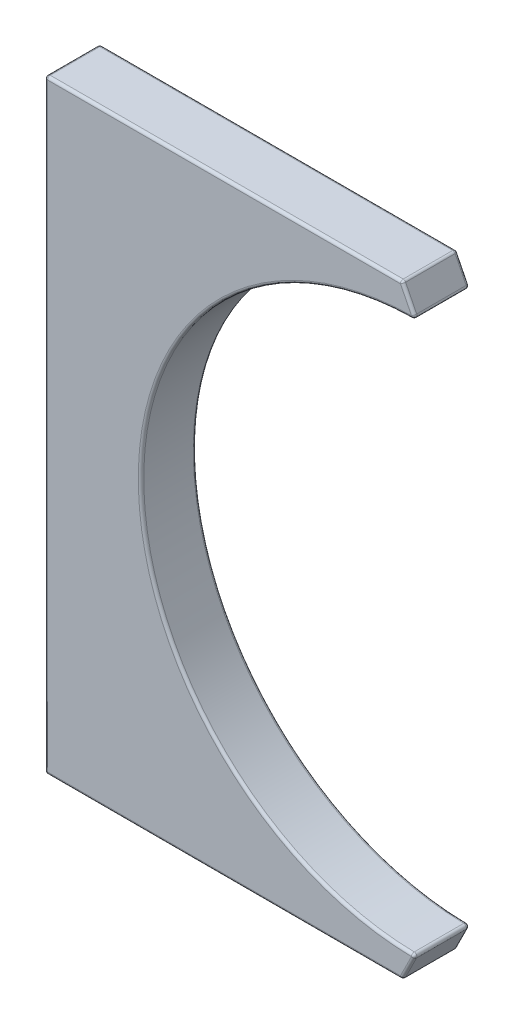
from build123d import *

# Parameters (mm, degrees)
BOSS_EXTRUDE1_DEPTH = 20
FILLET1_R           = 1


with BuildPart() as part:
    # Sketch2 → Boss-Extrude1 (new body)
    with BuildSketch(Plane.XY):
        with BuildLine():
            Line((0, 105.351887556), (0, -114.648112444))
            Line((0, -114.648112444), (130, -114.648112444))
            Line((130, -114.648112444), (135, -104.648112444))
            ThreePointArc((135, -104.648112444), (35, -4.648112444), (135, 95.351887556))
            Line((135, 95.351887556), (130, 105.351887556))
            Line((130, 105.351887556), (0, 105.351887556))
        make_face()
    extrude(amount=BOSS_EXTRUDE1_DEPTH)

    # Fillet1
    fillet1_edges = [part.edges().sort_by_distance(p)[0] for p in [
        (130, 105.351887556, 10),
        (135, 95.351887556, 10),
        (135, -104.648112444, 10),
        (130, -114.648112444, 10),
        (0, -114.648112444, 10),
        (0, 105.351887556, 10),
        (65, -114.648112444, 20),
        (132.5, -109.648112444, 20),
        (35, -4.648112444, 20),
        (132.5, 100.351887556, 20),
        (65, 105.351887556, 20),
        (132.5, 100.351887556, 0),
        (35, -4.648112444, 0),
        (132.5, -109.648112444, 0),
        (65, -114.648112444, 0),
        (0, -4.648112444, 0),
        (65, 105.351887556, 0),
        (0, -4.648112444, 20),
    ]]
    fillet(fillet1_edges, radius=FILLET1_R)


solid = part.part
